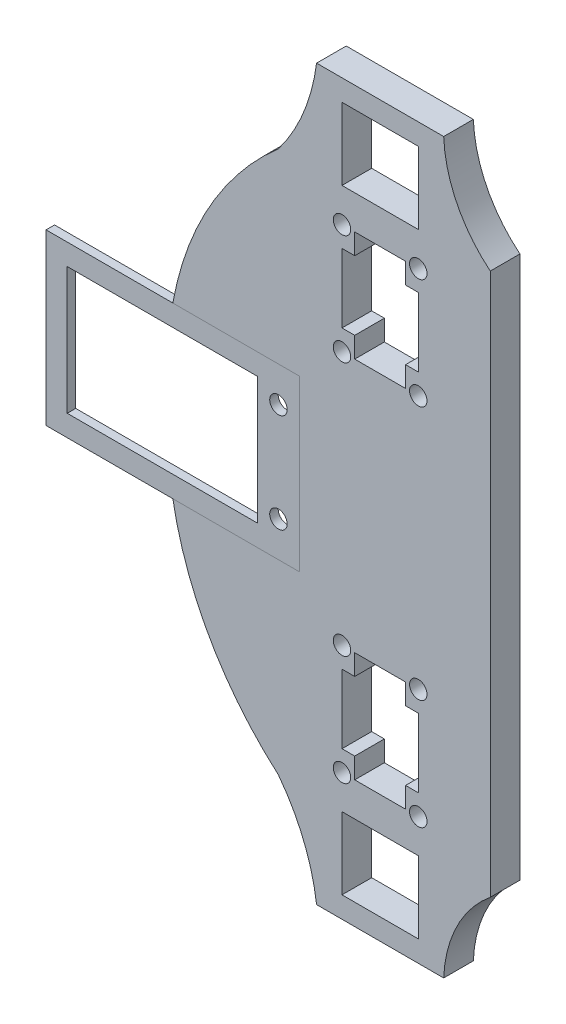
from build123d import *

# Parameters (mm, degrees)
SKETCH1_W           = 40
SKETCH1_H           = 59.85
SKETCH1_R           = 2.06
SKETCH1_W_2         = 30
SKETCH1_H_2         = 44.85
BOSS_EXTRUDE2_DEPTH = 2
SKETCH2_R           = 2.06
BOSS_EXTRUDE3_DEPTH = 7


with BuildPart() as part:
    # Sketch1 → Boss-Extrude2 (new body)
    with BuildSketch(Plane(origin=(0, 0, 0), x_dir=(0, 1, 0), z_dir=(0, 0, 1))):
        with Locations((0, 38.706068974)):
            Rectangle(SKETCH1_W, SKETCH1_H)
        with Locations(Location((-11.685, 13.781068974, 0), (0, 0, 270))):
            Circle(SKETCH1_R, mode=Mode.SUBTRACT)
        with Locations(Location((11.685, 13.781068974, 0), (0, 0, 270))):
            Circle(SKETCH1_R, mode=Mode.SUBTRACT)
        with Locations((0, 41.206068974)):
            Rectangle(SKETCH1_W_2, SKETCH1_H_2, mode=Mode.SUBTRACT)
    extrude(amount=BOSS_EXTRUDE2_DEPTH)


with BuildPart() as body_2:
    # Sketch2 → Boss-Extrude3 (new body)
    # profile 1 of 6: a face of its own
    with BuildSketch(Plane.XY.offset(2)):
        with BuildLine():
            Line((-13.781068974, -64), (-13.781068974, -20))
            Line((-13.781068974, -20), (-38.706068974, -20))
            ThreePointArc((-38.706068974, -20), (-30.004659229, -44.13057215), (-13.781068974, -64))
        make_face()
    # profile 2 of 6: a face of its own
    with BuildSketch(Plane.XY.offset(2)):
        with BuildLine():
            Line((-38.706068974, 20), (-13.781068974, 20))
            Line((-13.781068974, 20), (-13.781068974, 64))
            ThreePointArc((-13.781068974, 64), (-30.004659229, 44.13057215), (-38.706068974, 20))
        make_face()
    # profile 3 of 6: a face of its own
    with BuildSketch(Plane.XY.offset(2)):
        Polygon((36.218931026, 0), (-8.781068974, 0), (-8.781068974, -20), (-13.781068974, -20), (-13.781068974, -64), (1.218931026, -64), (19.218931026, -64), (36.218931026, -64), align=None)
        with BuildLine():
            ThreePointArc((3.278931026, -56), (2.675570995, -57.456639969), (1.218931026, -58.06))
            ThreePointArc((1.218931026, -58.06), (-0.237708943, -54.543360031), (3.278931026, -56))
        make_face(mode=Mode.SUBTRACT)
        with BuildLine():
            ThreePointArc((21.278931026, -56), (20.675570995, -57.456639969), (19.218931026, -58.06))
            ThreePointArc((19.218931026, -58.06), (17.762291057, -54.543360031), (21.278931026, -56))
        make_face(mode=Mode.SUBTRACT)
        Polygon((1.218931026, -34.867465412), (4.218931026, -34.867465412), (4.218931026, -30), (16.218931026, -30), (16.218931026, -34.867465412), (19.218931026, -34.867465412), (19.218931026, -51.132534588), (16.218931026, -51.132534588), (16.218931026, -56), (4.218931026, -56), (4.218931026, -51.132534588), (1.218931026, -51.132534588), align=None, mode=Mode.SUBTRACT)
        with Locations((1.218931026, -30)):
            Circle(SKETCH2_R, mode=Mode.SUBTRACT)
        with Locations((19.218931026, -30)):
            Circle(SKETCH2_R, mode=Mode.SUBTRACT)
    # profile 4 of 6: a face of its own
    with BuildSketch(Plane.XY.offset(2)):
        with BuildLine():
            ThreePointArc((25.218931026, -86), (28.360591797, -73.820830386), (36.218931026, -64))
            Line((36.218931026, -64), (19.218931026, -64))
            Line((19.218931026, -64), (19.218931026, -81))
            Line((19.218931026, -81), (1.218931026, -81))
            Line((1.218931026, -81), (1.218931026, -64))
            Line((1.218931026, -64), (-13.781068974, -64))
            ThreePointArc((-13.781068974, -64), (-7.838079551, -74.409686145), (-4.781068974, -86))
            Line((-4.781068974, -86), (25.218931026, -86))
        make_face()
    # profile 5 of 6: a face of its own
    with BuildSketch(Plane.XY.offset(2)):
        Polygon((-8.781068974, 20), (-8.781068974, 0), (36.218931026, 0), (36.218931026, 64), (19.218931026, 64), (1.218931026, 64), (-13.781068974, 64), (-13.781068974, 20), align=None)
        with Locations((1.218931026, 30)):
            Circle(SKETCH2_R, mode=Mode.SUBTRACT)
        with Locations((19.218931026, 30)):
            Circle(SKETCH2_R, mode=Mode.SUBTRACT)
        with BuildLine():
            ThreePointArc((3.278931026, 56), (-0.237708943, 54.543360031), (1.218931026, 58.06))
            ThreePointArc((1.218931026, 58.06), (2.675570995, 57.456639969), (3.278931026, 56))
        make_face(mode=Mode.SUBTRACT)
        Polygon((1.218931026, 34.867465412), (1.218931026, 51.132534588), (4.218931026, 51.132534588), (4.218931026, 56), (16.218931026, 56), (16.218931026, 51.132534588), (19.218931026, 51.132534588), (19.218931026, 34.867465412), (16.218931026, 34.867465412), (16.218931026, 30), (4.218931026, 30), (4.218931026, 34.867465412), align=None, mode=Mode.SUBTRACT)
        with BuildLine():
            ThreePointArc((21.278931026, 56), (17.762291057, 54.543360031), (19.218931026, 58.06))
            ThreePointArc((19.218931026, 58.06), (20.675570995, 57.456639969), (21.278931026, 56))
        make_face(mode=Mode.SUBTRACT)
    # profile 6 of 6: a face of its own
    with BuildSketch(Plane.XY.offset(2)):
        with BuildLine():
            Line((19.218931026, 64), (36.218931026, 64))
            ThreePointArc((36.218931026, 64), (28.360591797, 73.820830386), (25.218931026, 86))
            Line((25.218931026, 86), (-4.781068974, 86))
            ThreePointArc((-4.781068974, 86), (-7.838079551, 74.409686145), (-13.781068974, 64))
            Line((-13.781068974, 64), (1.218931026, 64))
            Line((1.218931026, 64), (1.218931026, 81))
            Line((1.218931026, 81), (19.218931026, 81))
            Line((19.218931026, 81), (19.218931026, 64))
        make_face()
    extrude(amount=-BOSS_EXTRUDE3_DEPTH)


solid = Compound([part.part, body_2.part])
